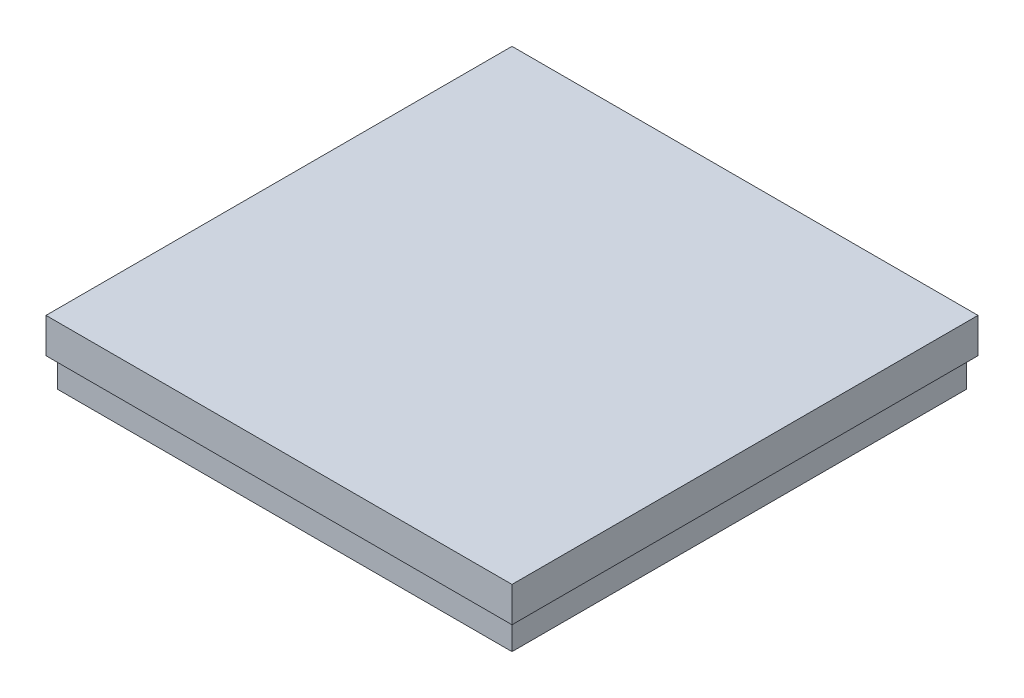
from build123d import *

# Parameters (mm, degrees)
SKETCH_1_W          = 39
SKETCH_1_H          = 39
EXTRUDE_1_DEPTH     = 5.5
SKETCH_2_W          = 39
SKETCH_2_H          = 3
EXTRUDE_2_DEPTH     = 0.5
SKETCH_3_W          = 39.5
SKETCH_3_H          = 3
EXTRUDE_3_DEPTH     = 0.5
SKETCH_5_W          = 39.5
SKETCH_5_H          = 3
EXTRUDE_4_DEPTH     = 0.5
SKETCH_6_W          = 40
SKETCH_6_H          = 3
EXTRUDE_5_DEPTH     = 0.5
SKETCH_7_W          = 38
SKETCH_7_H          = 38
CUT_EXTRUDE_1_DEPTH = 4.5


with BuildPart() as part:
    # Эскиз1 → Бобышка-Вытянуть1 (new body)
    with BuildSketch(Plane(origin=(0, 0, 0), x_dir=(1, 0, 0), z_dir=(0, 1, 0))):
        with Locations((2.720930233, -12.848837209)):
            Rectangle(SKETCH_1_W, SKETCH_1_H)
    extrude(amount=EXTRUDE_1_DEPTH)

    # Эскиз2 → Бобышка-Вытянуть2 (add)
    with BuildSketch(Plane.ZY.offset(16.779069767)):
        with Locations((12.848837209, 4)):
            Rectangle(SKETCH_2_W, SKETCH_2_H)
    extrude(amount=EXTRUDE_2_DEPTH)

    # Эскиз3 → Бобышка-Вытянуть3 (add)
    with BuildSketch(Plane.XY.offset(32.348837209)):
        with Locations((2.470930233, 4)):
            Rectangle(SKETCH_3_W, SKETCH_3_H)
    extrude(amount=EXTRUDE_3_DEPTH)

    # Эскиз5 → Бобышка-Вытянуть4 (add)
    with BuildSketch(Plane(origin=(22.220930233, 0, 0), x_dir=(0, 0, -1), z_dir=(1, 0, 0))):
        with Locations((-13.098837209, 4)):
            Rectangle(SKETCH_5_W, SKETCH_5_H)
    extrude(amount=EXTRUDE_4_DEPTH)

    # Эскиз6 → Бобышка-Вытянуть5 (add)
    with BuildSketch(Plane(origin=(0, 0, -6.651162791), x_dir=(-1, 0, 0), z_dir=(0, 0, -1))):
        with Locations((-2.720930233, 4)):
            Rectangle(SKETCH_6_W, SKETCH_6_H)
    extrude(amount=EXTRUDE_5_DEPTH)

    # Эскиз7 → Вырез-Вытянуть1 (cut)
    with BuildSketch(Plane.XZ):
        with Locations((2.720930233, 12.848837209)):
            Rectangle(SKETCH_7_W, SKETCH_7_H)
    extrude(amount=-CUT_EXTRUDE_1_DEPTH, mode=Mode.SUBTRACT)


solid = part.part
